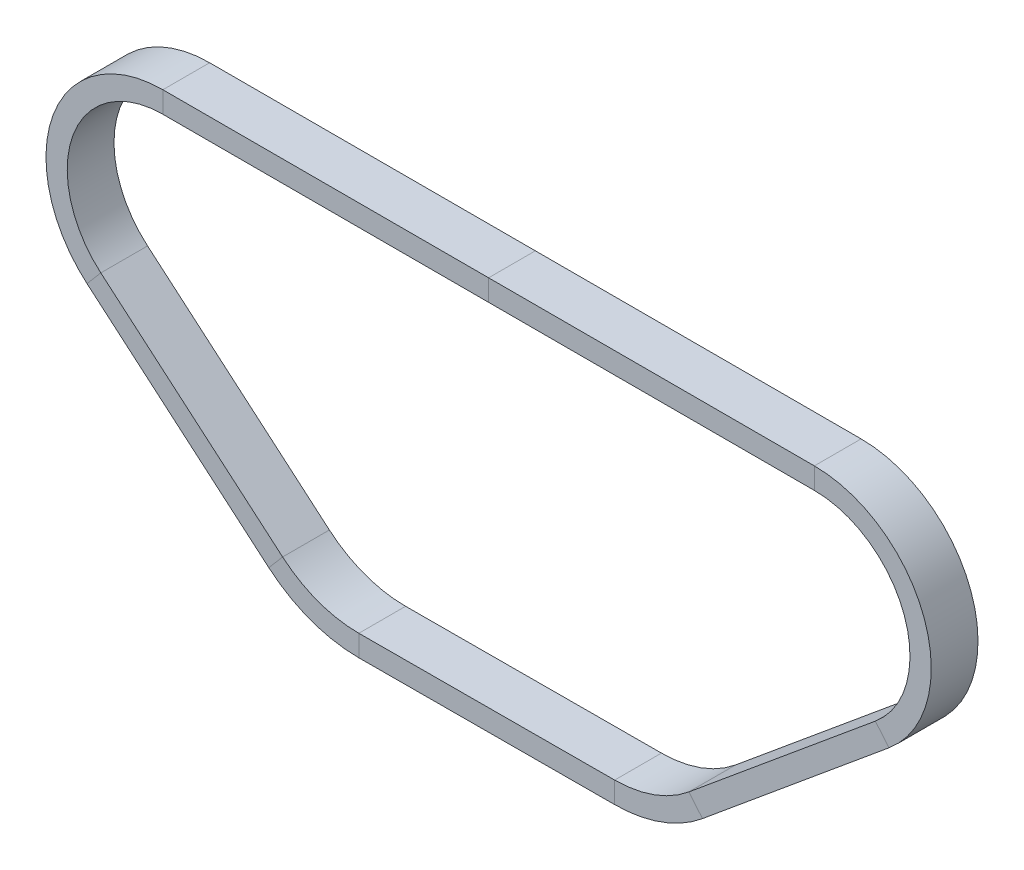
from build123d import *

# Parameters (mm, degrees)
SKETCH2_W = 110
SKETCH2_H = 50


with BuildPart() as part:
    # Sweep1: sweep along a path in Sketch1
    with BuildLine(Plane.XY) as sweep1_path:
        Line((-928.571456188, -1.771205441), (-500.834504508, -366.660824545))
        ThreePointArc((-500.834504508, -366.660824545), (-409.456348871, -420.071023724), (-305.217232836, -438.423772624))
        Line((-305.217232836, -438.423772624), (296.661049889, -436.585522244))
        ThreePointArc((296.661049889, -436.585522244), (397.913404434, -418.653537183), (487.162542163, -367.583126926))
        Line((487.162542163, -367.583126926), (925.835394358, -4.071666076))
        ThreePointArc((925.835394358, -4.071666076), (1001.50586317, 273.206627713), (766.320606962, 438.425171825))
        Line((766.320606962, 438.425171825), (-766.320606962, 438.425171825))
        ThreePointArc((-766.320606962, 438.425171825), (-1000.893723832, 274.885872966), (-928.571456188, -1.771205441))
    # Sketch2 → Sweep1 (sweep)
    with BuildSketch(Plane(origin=(0, 0, 0), x_dir=(0, 0, -1), z_dir=(1, 0, 0))):
        with Locations((0, 438.425171825)):
            Rectangle(SKETCH2_W, SKETCH2_H)
    sweep(path=sweep1_path.line)


solid = part.part
